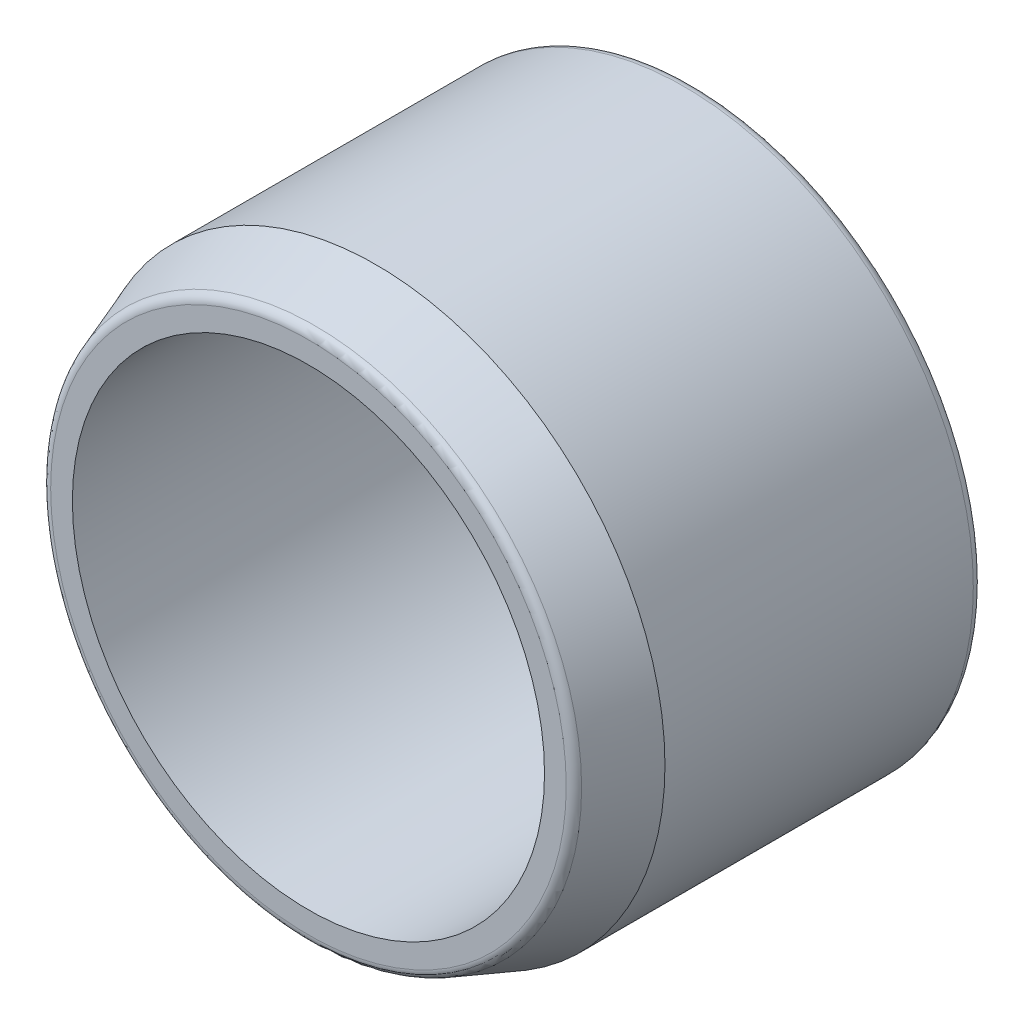
from build123d import *

# Parameters (mm, degrees)
SZKIC1_R                    = 30
SZKIC1_R_2                  = 24.5
DODANIE_WYCI_GNI_CIE1_DEPTH = 40
SFAZOWANIE1_SIZE            = 7
SFAZOWANIE1_SIZE2           = 2.54779164
ZAOKR_GLENIE1_R             = 1


with BuildPart() as part:
    # Szkic1 → Dodanie-wyciągnięcie1 (new body)
    with BuildSketch(Plane.XY):
        Circle(SZKIC1_R)
        Circle(SZKIC1_R_2, mode=Mode.SUBTRACT)
    extrude(amount=DODANIE_WYCI_GNI_CIE1_DEPTH)

    # Sfazowanie1
    sfazowanie1_edges = [part.edges().sort_by_distance(p)[0] for p in [
        (-30, 0, 40),
    ]]
    sfazowanie1_side = [part.faces().sort_by_distance(p)[0] for p in [
        (-30, 0, 20),
    ]]
    chamfer(sfazowanie1_edges, length=SFAZOWANIE1_SIZE, length2=SFAZOWANIE1_SIZE2, reference=sfazowanie1_side[0])

    # Zaokrąglenie1
    zaokr_glenie1_edges = [part.edges().sort_by_distance(p)[0] for p in [
        (-30, 0, 0),
        (-27.45220836, 0, 40),
    ]]
    fillet(zaokr_glenie1_edges, radius=ZAOKR_GLENIE1_R)


solid = part.part
